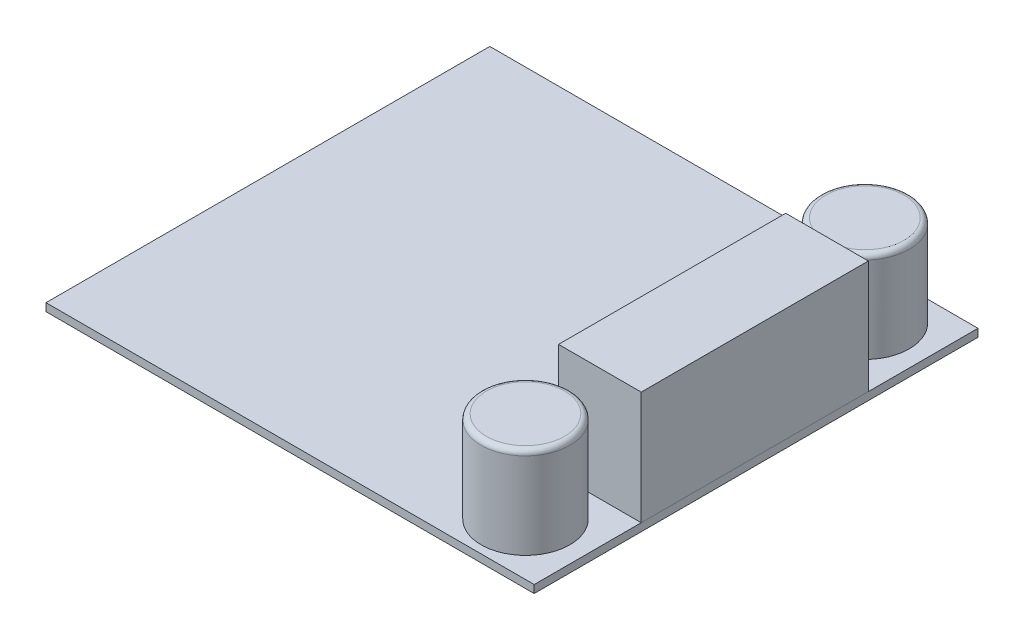
from build123d import *

# Parameters (mm, degrees)
SKIZZE1_W                       = 56.1
SKIZZE1_H                       = 51
AUFSATZ_LINEAR_AUSTRAGEN1_DEPTH = 0.9
SKIZZE2_W                       = 9.5
SKIZZE2_H                       = 26.1
AUFSATZ_LINEAR_AUSTRAGEN2_DEPTH = 13
SKIZZE3_R                       = 5.1
AUFSATZ_LINEAR_AUSTRAGEN3_DEPTH = 10.5
VERRUNDUNG1_R                   = 0.6


with BuildPart() as part:
    # Skizze1 → Aufsatz-Linear austragen1 (new body)
    with BuildSketch(Plane(origin=(0, 0, 0), x_dir=(1, 0, 0), z_dir=(0, 1, 0))):
        Rectangle(SKIZZE1_W, SKIZZE1_H)
    extrude(amount=AUFSATZ_LINEAR_AUSTRAGEN1_DEPTH)

    # Skizze3 → Aufsatz-Linear austragen3 (add)
    with BuildSketch(Plane(origin=(0, 0.9, 0), x_dir=(1, 0, 0), z_dir=(0, 1, 0))):
        with Locations(Location((21.05, 19.5, 0), (0, 0, 90))):
            Circle(SKIZZE3_R)
        with Locations(Location((21.05, -19.5, 0), (0, 0, 90))):
            Circle(SKIZZE3_R)
    extrude(amount=AUFSATZ_LINEAR_AUSTRAGEN3_DEPTH)

    # Verrundung1
    verrundung1_edges = [part.edges().sort_by_distance(p)[0] for p in [
        (21.05, 11.4, -14.4),
        (21.05, 11.4, 24.6),
    ]]
    fillet(verrundung1_edges, radius=VERRUNDUNG1_R)


with BuildPart() as body_2:
    # Skizze2 → Aufsatz-Linear austragen2 (new body)
    with BuildSketch(Plane(origin=(0, 0.9, 0), x_dir=(1, 0, 0), z_dir=(0, 1, 0))):
        with Locations((23.3, -0.15)):
            Rectangle(SKIZZE2_W, SKIZZE2_H)
    extrude(amount=AUFSATZ_LINEAR_AUSTRAGEN2_DEPTH)


solid = Compound([part.part, body_2.part])
